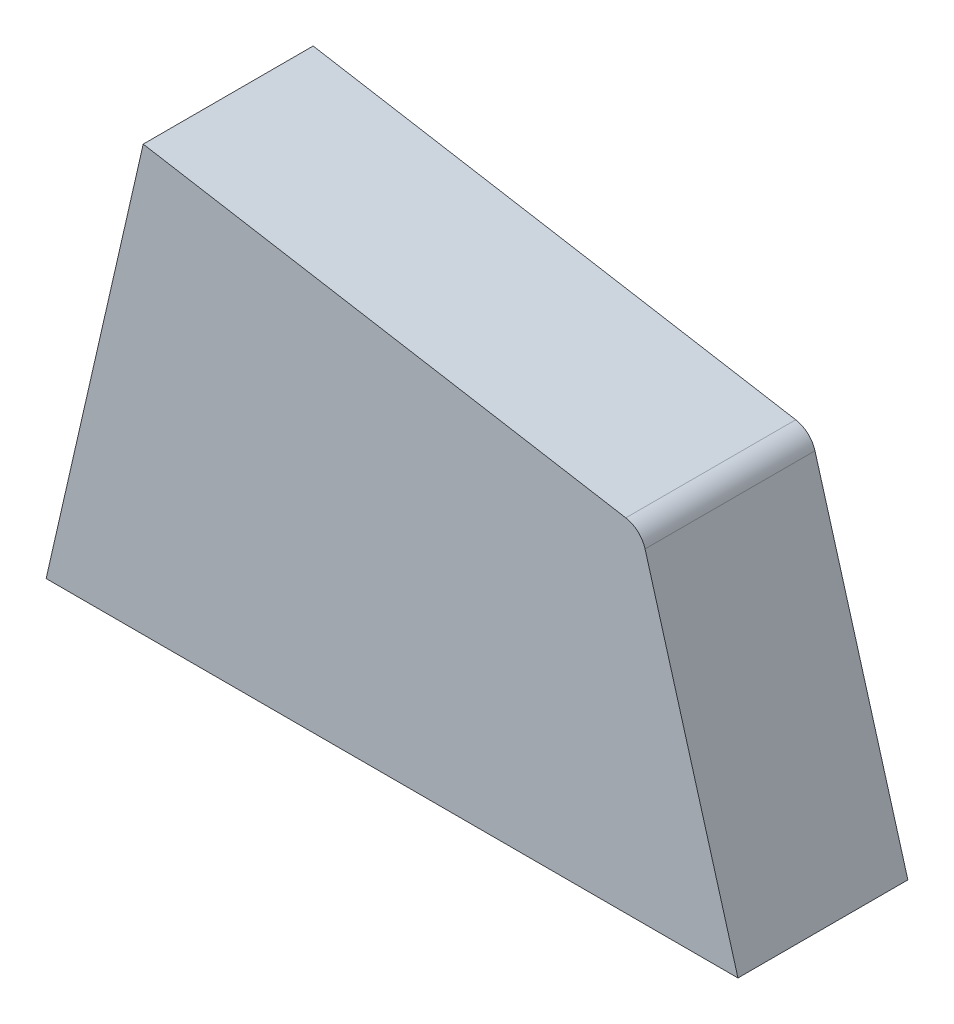
from build123d import *

# Parameters (mm, degrees)
BOSS_EXTRUDE1_DEPTH = 14
FILLET1_R           = 2


with BuildPart() as part:
    # Sketch1 → Boss-Extrude1 (new body)
    with BuildSketch(Plane.XY):
        Polygon((4, 3), (61, 3), (53, 31), (12, 38), align=None)
    extrude(amount=BOSS_EXTRUDE1_DEPTH)

    # Fillet1
    fillet1_edges = [part.edges().sort_by_distance(p)[0] for p in [
        (53, 31, 7),
    ]]
    fillet(fillet1_edges, radius=FILLET1_R)


solid = part.part
